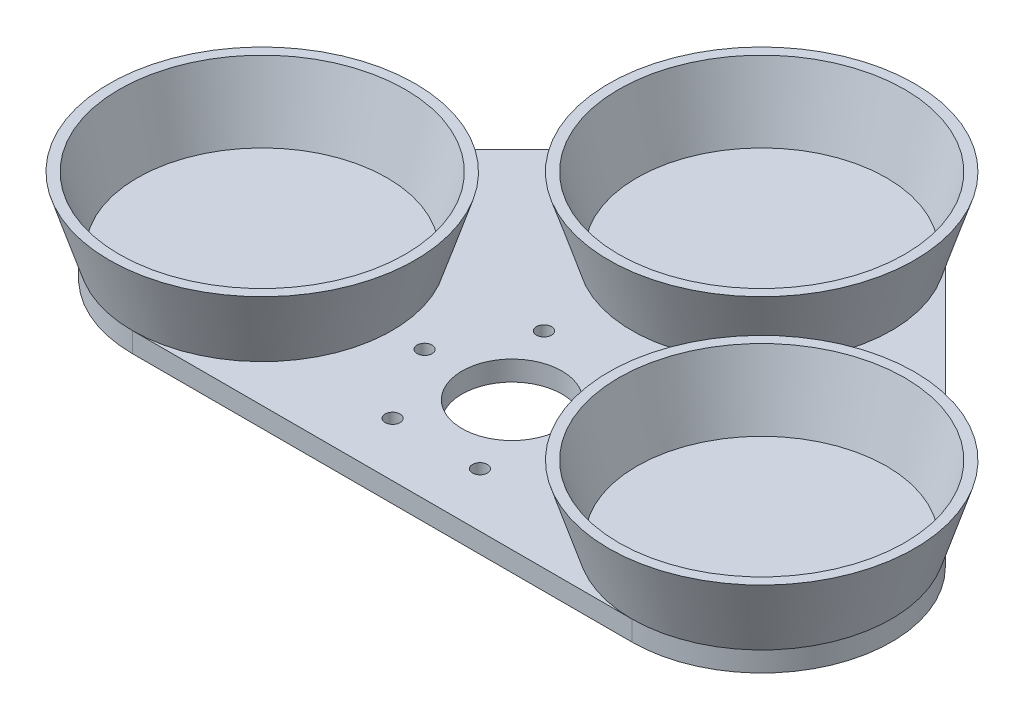
from build123d import *

# Parameters (mm, degrees)
SKETCH_1_R          = 26
EXTRUDE_1_DEPTH     = 1
EXTRUDE_1_2_DEPTH   = 1
EXTRUDE_1_3_DEPTH   = 1
EXTRUDE_START       = 4
SKETCH_2_R          = 10
EXTRUDE_2_DEPTH     = 4
SKETCH_3_R          = 1.5
CUT_EXTRUDE_1_DEPTH = 4


with BuildPart() as part:
    # 草图1 → 凸台-拉伸1 (new body)
    with BuildSketch(Plane(origin=(0, 0, 0), x_dir=(1, 0, 0), z_dir=(0, 1, 0))):
        with Locations(Location((0, 50, 0), (0, 0, 270))):
            Circle(SKETCH_1_R)
    extrude(amount=EXTRUDE_1_DEPTH)



with BuildPart() as body_2:
    # 草图1 → Extrude 1 2 (new body)
    with BuildSketch(Plane(origin=(0, 0, 0), x_dir=(1, 0, 0), z_dir=(0, 1, 0))):
        with Locations(Location((50, 0, 0), (0, 0, 270))):
            Circle(SKETCH_1_R)
    extrude(amount=EXTRUDE_1_2_DEPTH)


with BuildPart() as body_3:
    # 草图1 → Extrude 1 3 (new body)
    with BuildSketch(Plane(origin=(0, 0, 0), x_dir=(1, 0, 0), z_dir=(0, 1, 0))):
        with Locations(Location((-50, 0, 0), (0, 0, 270))):
            Circle(SKETCH_1_R)
    extrude(amount=EXTRUDE_1_3_DEPTH)


with BuildPart() as part_1:
    add(part.part)

    add(body_2.part)  # 凸台-拉伸2 merges body 2

    add(body_3.part)  # 凸台-拉伸2 merges body 3
    # 草图2 → 凸台-拉伸2 (add)
    with BuildSketch(Plane.XZ.offset(EXTRUDE_START)):
        with BuildLine():
            Line((-50, 26), (50, 26))
            ThreePointArc((50, 26), (74.020867845, 9.949769241), (68.384776311, -18.384776311))
            Line((68.384776311, -18.384776311), (18.384776311, -68.384776311))
            ThreePointArc((18.384776311, -68.384776311), (0, -76), (-18.384776311, -68.384776311))
            Line((-18.384776311, -68.384776311), (-68.384776311, -18.384776311))
            ThreePointArc((-68.384776311, -18.384776311), (-74.020867845, 9.949769241), (-50, 26))
        make_face()
        with Locations(Location((0, 0, 0), (0, 0, 270))):
            Circle(SKETCH_2_R, mode=Mode.SUBTRACT)
    extrude(amount=-EXTRUDE_2_DEPTH)

    # 草图3 → 切除-拉伸1 (cut)
    with BuildSketch(Plane(origin=(0, 0, 0), x_dir=(1, 0, 0), z_dir=(0, 1, 0))):
        with Locations(Location((8.75, 15.155444566, 0), (0, 0, 270))):
            Circle(SKETCH_3_R)
        with Locations(Location((17.5, 0, 0), (0, 0, 270))):
            Circle(SKETCH_3_R)
        with Locations(Location((-17.5, 0, 0), (0, 0, 90))):
            Circle(SKETCH_3_R)
        with Locations(Location((-8.75, 15.155444566, 0), (0, 0, 90))):
            Circle(SKETCH_3_R)
        with Locations(Location((-8.75, -15.155444566, 0), (0, 0, 270))):
            Circle(SKETCH_3_R)
        with Locations(Location((8.75, -15.155444566, 0), (0, 0, 90))):
            Circle(SKETCH_3_R)
    extrude(amount=-CUT_EXTRUDE_1_DEPTH, mode=Mode.SUBTRACT)

    # 草图4 → 旋转1 (revolve)
    with BuildSketch(Plane(origin=(0, 0, 0), x_dir=(0, 0, -1), z_dir=(1, 0, 0)), mode=Mode.PRIVATE) as revolve_1_sk:
        Polygon((80.623466631, 14.522961568), (78.623466631, 14.522961568), (75, 1), (76, 1), (76, 0), align=None)
    revolve(revolve_1_sk.sketch.rotate(Axis((0, 1, -50), (0, 1, 0)), 180), axis=Axis((0, 1, -50), (0, 1, 0)))

    # 草图6 → 旋转2 (revolve)
    with BuildSketch(Plane.XY, mode=Mode.PRIVATE) as revolve_2_sk:
        Polygon((-75, 1), (-78.623466631, 14.522961568), (-80.623466631, 14.522961568), (-76, 0), (-76, 1), align=None)
    revolve(revolve_2_sk.sketch.rotate(Axis((-50, 1, 0), (0, 1, 0)), 90), axis=Axis((-50, 1, 0), (0, 1, 0)))

    # 草图7 → 旋转3 (revolve)
    with BuildSketch(Plane.XY, mode=Mode.PRIVATE) as revolve_3_sk:
        Polygon((75, 1), (76, 1), (76, 0), (80.623466631, 14.522961568), (78.623466631, 14.522961568), align=None)
    revolve(revolve_3_sk.sketch.rotate(Axis((50, 1, 0), (0, 1, 0)), 270), axis=Axis((50, 1, 0), (0, 1, 0)))


solid = part_1.part
